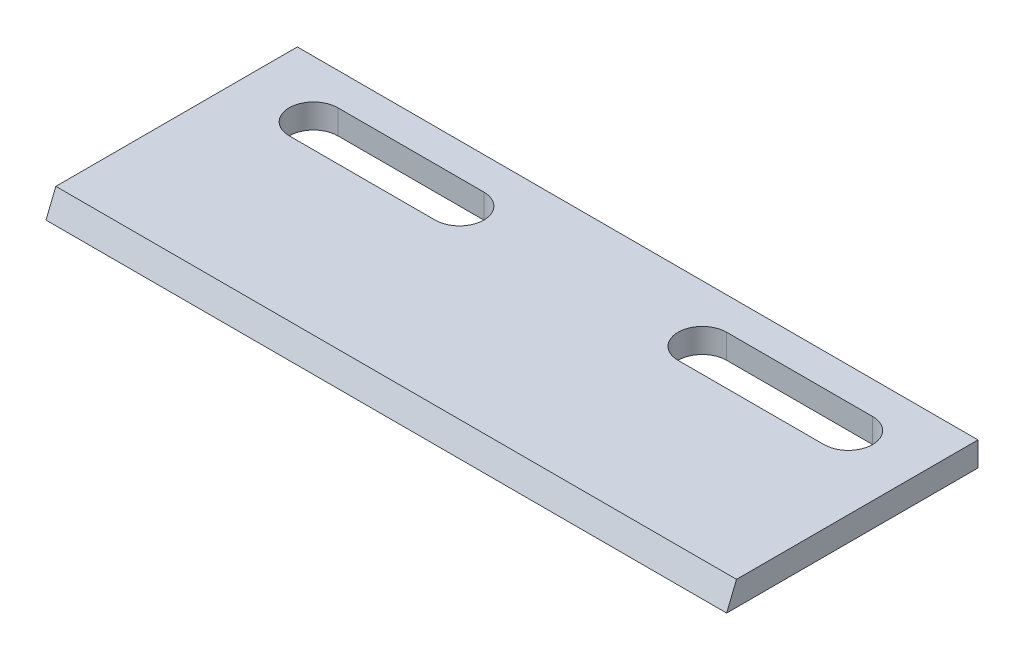
from build123d import *

# Parameters (mm, degrees)
SKETCH1_W           = 533.146
SKETCH1_H           = 196.863399688
BOSS_EXTRUDE1_DEPTH = 19.05
CUT_EXTRUDE1_DEPTH  = 7702.120410186
CUT_EXTRUDE2_DEPTH  = 7008.877833132


with BuildPart() as part:
    # Sketch1 → Boss-Extrude1 (new body)
    with BuildSketch(Plane(origin=(0, 3140.71, 0), x_dir=(1, 0, 0), z_dir=(0, 1, 0))):
        with Locations((0, 6904.348295077)):
            Rectangle(SKETCH1_W, SKETCH1_H)
    extrude(amount=BOSS_EXTRUDE1_DEPTH)

    # Sketch2 → Cut-Extrude1 (cut, through all)
    with BuildSketch(Plane(origin=(266.573, 0, 0), x_dir=(0, 0, -1), z_dir=(1, 0, 0))):
        Polygon((6805.916595233, 3140.710000001), (6813.613294835, 3159.760000001), (6805.916595233, 3159.760000001), align=None)
    extrude(amount=-CUT_EXTRUDE1_DEPTH, mode=Mode.SUBTRACT)

    # Sketch3 → Cut-Extrude2 (cut, through all)
    with BuildSketch(Plane(origin=(0, 3159.76, 0), x_dir=(1, 0, 0), z_dir=(0, 1, 0))):
        with BuildLine():
            Line((209.423, 6939.279994921), (95.123, 6939.279994921))
            ThreePointArc((95.123, 6939.279994921), (76.073, 6958.329994921), (95.123, 6977.379994921))
            Line((95.123, 6977.379994921), (209.423, 6977.379994921))
            ThreePointArc((209.423, 6977.379994921), (228.473, 6958.329994921), (209.423, 6939.279994921))
        make_face()
        with BuildLine():
            Line((-209.423, 6939.279994921), (-95.123, 6939.279994921))
            ThreePointArc((-95.123, 6939.279994921), (-76.073, 6958.329994921), (-95.123, 6977.379994921))
            Line((-95.123, 6977.379994921), (-209.423, 6977.379994921))
            ThreePointArc((-209.423, 6977.379994921), (-228.473, 6958.329994921), (-209.423, 6939.279994921))
        make_face()
    extrude(amount=-CUT_EXTRUDE2_DEPTH, mode=Mode.SUBTRACT)


solid = part.part
